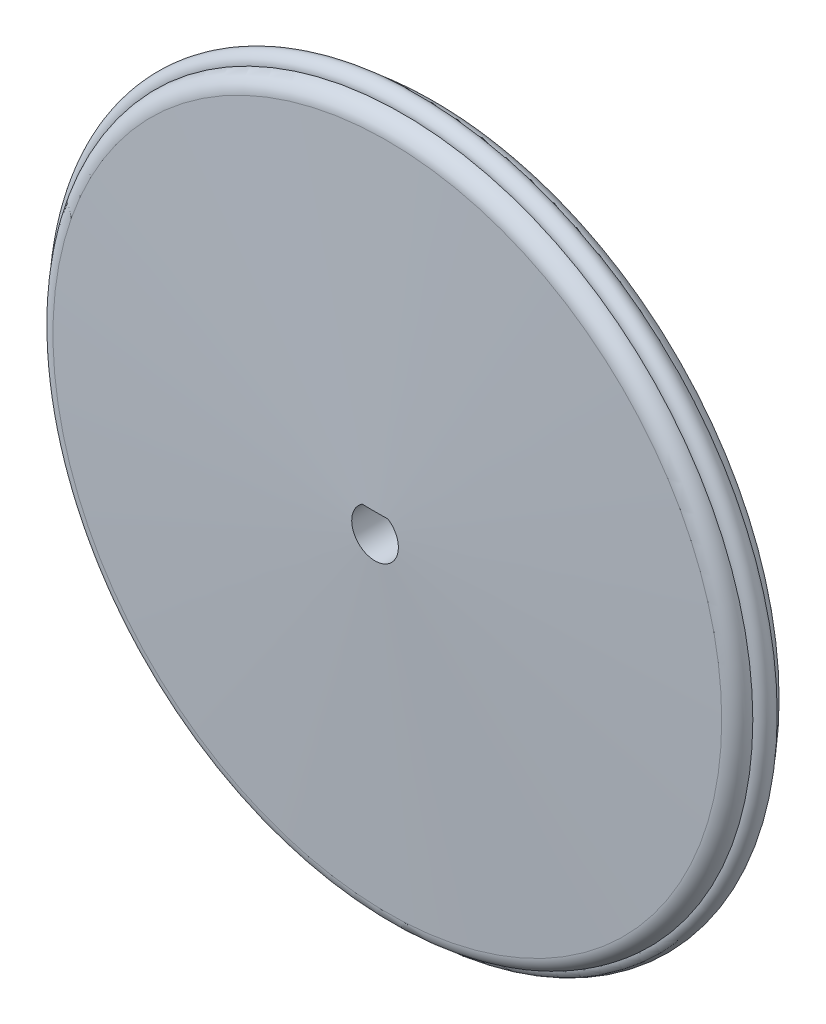
from build123d import *

# Parameters (mm, degrees)
ENL_V_MAT_EXTRU_3_DEPTH      = 64.835726674
ENL_V_MAT_EXTRU_3_DEPTH_BACK = 64.835726674
ESQUISSE4_R                  = 1.3


with BuildPart() as part:
    # Esquisse2 → Révolution1 (revolve)
    with BuildSketch(Plane(origin=(0, 0, 0), x_dir=(0, 0, -1), z_dir=(1, 0, 0)), mode=Mode.PRIVATE) as r_volution1_sk:
        with BuildLine():
            Line((5, 0), (-5, 0))
            Line((-5, 0), (-3.3, 43))
            ThreePointArc((-3.3, 43), (-2.691251544, 44.391251544), (-1.3, 45))
            ThreePointArc((-1.3, 45), (0, 43.7), (1.3, 45))
            ThreePointArc((1.3, 45), (2.691251544, 44.391251544), (3.3, 43))
            Line((3.3, 43), (5, 0))
        make_face()
    revolve(r_volution1_sk.sketch.rotate(Axis((0, 0, 77.254476924), (0, 0, -1)), 90), axis=Axis((0, 0, 77.254476924), (0, 0, -1)))

    # Esquisse3 → Enlèv. mat.-Extru.3 (cut, two sides: drawn at the far end of the back side and taken through both)
    with BuildSketch(Plane.XY.offset(-ENL_V_MAT_EXTRU_3_DEPTH_BACK)):
        with BuildLine():
            Line((-1.658312395, 2.5), (1.658312395, 2.5))
            ThreePointArc((1.658312395, 2.5), (0, -3), (-1.658312395, 2.5))
        make_face()
    extrude(amount=ENL_V_MAT_EXTRU_3_DEPTH + ENL_V_MAT_EXTRU_3_DEPTH_BACK, mode=Mode.SUBTRACT)

    # Esquisse4 → Révolution2 (revolve)
    with BuildSketch(Plane(origin=(0, 0, 0), x_dir=(0, 0, -1), z_dir=(1, 0, 0)), mode=Mode.PRIVATE) as r_volution2_sk:
        with Locations((0, 45)):
            Circle(ESQUISSE4_R)
    revolve(r_volution2_sk.sketch.rotate(Axis((0, 0, 0), (0, 0, -1)), 326.442690238), axis=Axis((0, 0, 0), (0, 0, -1)))


solid = part.part
